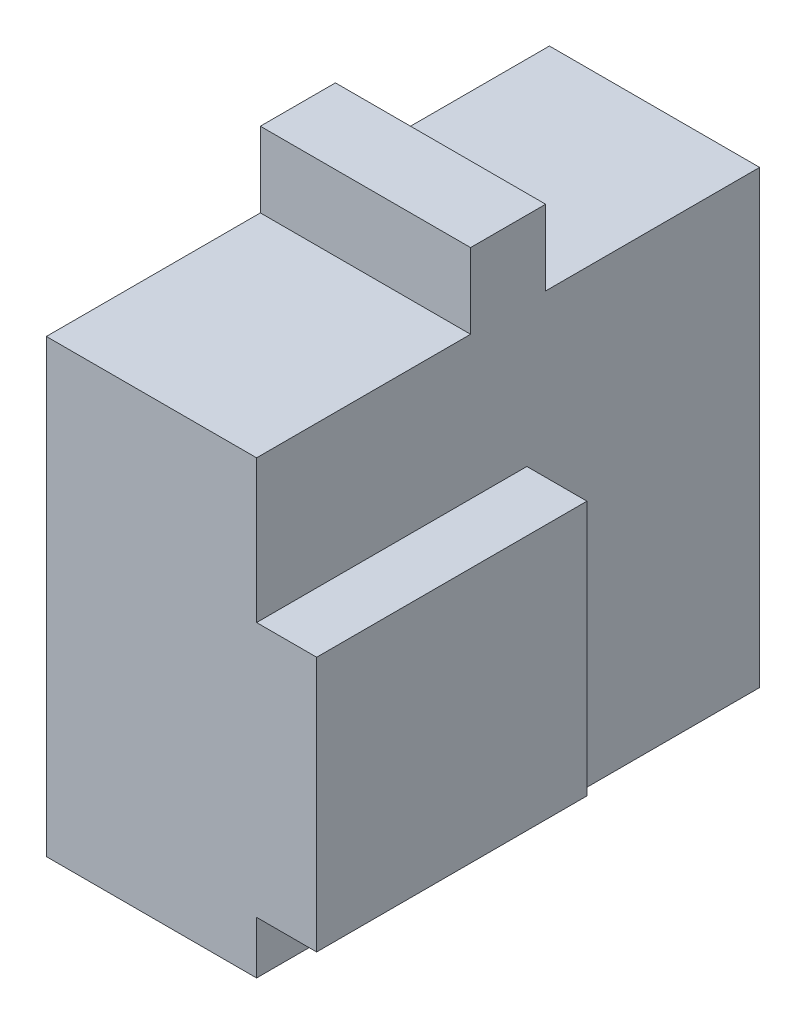
from build123d import *

# Parameters (mm, degrees)
SKETCH1_W           = 67
SKETCH1_H           = 60
BOSS_EXTRUDE1_DEPTH = 28
SKETCH3_W           = 36
SKETCH3_H           = 34
BOSS_EXTRUDE2_DEPTH = 8
SKETCH4_W           = 28
SKETCH4_H           = 10
BOSS_EXTRUDE3_DEPTH = 10


with BuildPart() as part:
    # Sketch1 → Boss-Extrude1 (new body)
    with BuildSketch(Plane(origin=(0, 0, 0), x_dir=(0, 0, -1), z_dir=(1, 0, 0))):
        Rectangle(SKETCH1_W, SKETCH1_H)
    extrude(amount=BOSS_EXTRUDE1_DEPTH)

    # Sketch3 → Boss-Extrude2 (add)
    with BuildSketch(Plane(origin=(28, 0, 0), x_dir=(0, 0, -1), z_dir=(1, 0, 0))):
        with Locations((-15.5, -6)):
            Rectangle(SKETCH3_W, SKETCH3_H)
    extrude(amount=BOSS_EXTRUDE2_DEPTH)

    # Sketch4 → Boss-Extrude3 (add)
    with BuildSketch(Plane(origin=(0, 30, 0), x_dir=(1, 0, 0), z_dir=(0, 1, 0))):
        with Locations((14, 0)):
            Rectangle(SKETCH4_W, SKETCH4_H)
    extrude(amount=BOSS_EXTRUDE3_DEPTH)


solid = part.part
